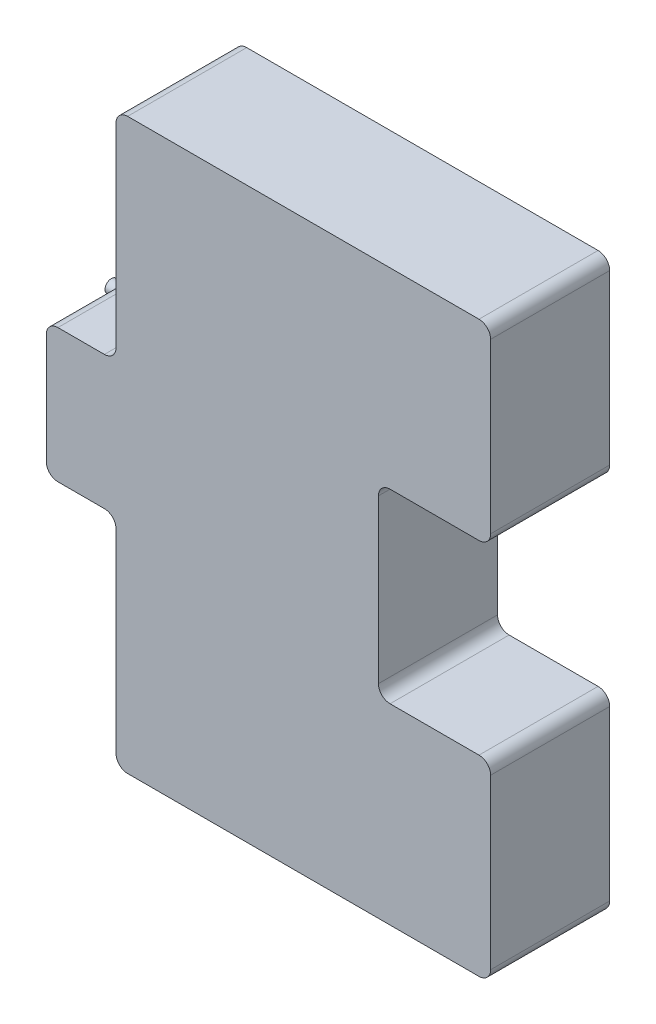
from build123d import *

# Parameters (mm, degrees)
BOSS_EXTRUDE1_DEPTH = 10
FILLET1_R           = 20
BOSS_EXTRUDE2_START = 180
BOSS_EXTRUDE2_DEPTH = 180
BOSS_EXTRUDE3_START = 15
BOSS_EXTRUDE3_DEPTH = 15
BOSS_EXTRUDE4_DEPTH = 15
BOSS_EXTRUDE5_START = 15
SKETCH4_3_R         = 11
BOSS_EXTRUDE5_DEPTH = 38


with BuildPart() as part:
    # Sketch1 → Boss-Extrude1 (new body)
    with BuildSketch(Plane.XY):
        Polygon((-335.812036678, 398.75165032), (309.187963322, 398.75165032), (309.187963322, 68.75165032), (116.024594022, 68.75165032), (116.024594022, -251.24834968), (309.187963322, -251.24834968), (309.187963322, -581.24834968), (-335.812036678, -581.24834968), (-335.812036678, -206.24834968), (-455.812036678, -206.24834968), (-455.812036678, 23.75165032), (-335.812036678, 23.75165032), align=None)
    extrude(amount=BOSS_EXTRUDE1_DEPTH)

    # Fillet1
    fillet1_edges = [part.edges().sort_by_distance(p)[0] for p in [
        (-335.812036678, -206.24834968, 5),
        (-455.812036678, -206.24834968, 5),
        (-455.812036678, 23.75165032, 5),
        (-335.812036678, 23.75165032, 5),
        (-335.812036678, 398.75165032, 5),
        (309.187963322, 398.75165032, 5),
        (309.187963322, 68.75165032, 5),
        (116.024594022, 68.75165032, 5),
        (116.024594022, -251.24834968, 5),
        (309.187963322, -251.24834968, 5),
        (309.187963322, -581.24834968, 5),
        (-335.812036678, -581.24834968, 5),
    ]]
    fillet(fillet1_edges, radius=FILLET1_R)

    # Sketch2 → Boss-Extrude2 (add)
    with BuildSketch(Plane.XY.offset(10).offset(BOSS_EXTRUDE2_START)):
        with BuildLine():
            Line((309.187963322, 88.75165032), (309.187963322, 378.75165032))
            ThreePointArc((309.187963322, 378.75165032), (303.330098945, 392.893785944), (289.187963322, 398.75165032))
            Line((289.187963322, 398.75165032), (-315.812036678, 398.75165032))
            ThreePointArc((-315.812036678, 398.75165032), (-329.954172302, 392.893785944), (-335.812036678, 378.75165032))
            Line((-335.812036678, 378.75165032), (-335.812036678, 43.75165032))
            ThreePointArc((-335.812036678, 43.75165032), (-341.669901055, 29.609514696), (-355.812036678, 23.75165032))
            Line((-355.812036678, 23.75165032), (-435.812036678, 23.75165032))
            ThreePointArc((-435.812036678, 23.75165032), (-449.954172302, 17.893785944), (-455.812036678, 3.75165032))
            Line((-455.812036678, 3.75165032), (-455.812036678, -186.24834968))
            ThreePointArc((-455.812036678, -186.24834968), (-449.954172302, -200.390485304), (-435.812036678, -206.24834968))
            Line((-435.812036678, -206.24834968), (-355.812036678, -206.24834968))
            ThreePointArc((-355.812036678, -206.24834968), (-341.669901055, -212.106214056), (-335.812036678, -226.24834968))
            Line((-335.812036678, -226.24834968), (-335.812036678, -561.24834968))
            ThreePointArc((-335.812036678, -561.24834968), (-329.954172302, -575.390485304), (-315.812036678, -581.24834968))
            Line((-315.812036678, -581.24834968), (289.187963322, -581.24834968))
            ThreePointArc((289.187963322, -581.24834968), (303.330098945, -575.390485304), (309.187963322, -561.24834968))
            Line((309.187963322, -561.24834968), (309.187963322, -271.24834968))
            ThreePointArc((309.187963322, -271.24834968), (303.330098945, -257.106214056), (289.187963322, -251.24834968))
            Line((289.187963322, -251.24834968), (136.024594022, -251.24834968))
            ThreePointArc((136.024594022, -251.24834968), (121.882458398, -245.390485304), (116.024594022, -231.24834968))
            Line((116.024594022, -231.24834968), (116.024594022, 48.75165032))
            ThreePointArc((116.024594022, 48.75165032), (121.882458398, 62.893785944), (136.024594022, 68.75165032))
            Line((136.024594022, 68.75165032), (289.187963322, 68.75165032))
            ThreePointArc((289.187963322, 68.75165032), (303.330098945, 74.609514696), (309.187963322, 88.75165032))
        make_face()
        with BuildLine():
            Line((299.187963322, 88.75165032), (299.187963322, 378.75165032))
            ThreePointArc((299.187963322, 378.75165032), (296.259031134, 385.822718132), (289.187963322, 388.75165032))
            Line((289.187963322, 388.75165032), (-315.812036678, 388.75165032))
            ThreePointArc((-315.812036678, 388.75165032), (-322.88310449, 385.822718132), (-325.812036678, 378.75165032))
            Line((-325.812036678, 378.75165032), (-325.812036678, 43.75165032))
            ThreePointArc((-325.812036678, 43.75165032), (-334.598833243, 22.538446884), (-355.812036678, 13.75165032))
            Line((-355.812036678, 13.75165032), (-435.812036678, 13.75165032))
            ThreePointArc((-435.812036678, 13.75165032), (-442.88310449, 10.822718132), (-445.812036678, 3.75165032))
            Line((-445.812036678, 3.75165032), (-445.812036678, -186.24834968))
            ThreePointArc((-445.812036678, -186.24834968), (-442.88310449, -193.319417492), (-435.812036678, -196.24834968))
            Line((-435.812036678, -196.24834968), (-355.812036678, -196.24834968))
            ThreePointArc((-355.812036678, -196.24834968), (-334.598833243, -205.035146245), (-325.812036678, -226.24834968))
            Line((-325.812036678, -226.24834968), (-325.812036678, -561.24834968))
            ThreePointArc((-325.812036678, -561.24834968), (-322.88310449, -568.319417492), (-315.812036678, -571.24834968))
            Line((-315.812036678, -571.24834968), (289.187963322, -571.24834968))
            ThreePointArc((289.187963322, -571.24834968), (296.259031134, -568.319417492), (299.187963322, -561.24834968))
            Line((299.187963322, -561.24834968), (299.187963322, -271.24834968))
            ThreePointArc((299.187963322, -271.24834968), (296.259031134, -264.177281868), (289.187963322, -261.24834968))
            Line((289.187963322, -261.24834968), (136.024594022, -261.24834968))
            ThreePointArc((136.024594022, -261.24834968), (114.811390587, -252.461553116), (106.024594022, -231.24834968))
            Line((106.024594022, -231.24834968), (106.024594022, 48.75165032))
            ThreePointArc((106.024594022, 48.75165032), (114.811390587, 69.964853755), (136.024594022, 78.75165032))
            Line((136.024594022, 78.75165032), (289.187963322, 78.75165032))
            ThreePointArc((289.187963322, 78.75165032), (296.259031134, 81.680582508), (299.187963322, 88.75165032))
        make_face(mode=Mode.SUBTRACT)
    extrude(amount=-BOSS_EXTRUDE2_DEPTH)

    # Sketch3 → Boss-Extrude3 (add)
    with BuildSketch(Plane.XY.offset(190).offset(BOSS_EXTRUDE3_START)):
        with BuildLine():
            Line((309.187963322, 88.75165032), (309.187963322, 378.75165032))
            ThreePointArc((309.187963322, 378.75165032), (303.330098945, 392.893785944), (289.187963322, 398.75165032))
            Line((289.187963322, 398.75165032), (-315.812036678, 398.75165032))
            ThreePointArc((-315.812036678, 398.75165032), (-329.954172302, 392.893785944), (-335.812036678, 378.75165032))
            Line((-335.812036678, 378.75165032), (-335.812036678, 43.75165032))
            ThreePointArc((-335.812036678, 43.75165032), (-341.669901055, 29.609514696), (-355.812036678, 23.75165032))
            Line((-355.812036678, 23.75165032), (-435.812036678, 23.75165032))
            ThreePointArc((-435.812036678, 23.75165032), (-449.954172302, 17.893785944), (-455.812036678, 3.75165032))
            Line((-455.812036678, 3.75165032), (-455.812036678, -186.24834968))
            ThreePointArc((-455.812036678, -186.24834968), (-449.954172302, -200.390485304), (-435.812036678, -206.24834968))
            Line((-435.812036678, -206.24834968), (-355.812036678, -206.24834968))
            ThreePointArc((-355.812036678, -206.24834968), (-341.669901055, -212.106214056), (-335.812036678, -226.24834968))
            Line((-335.812036678, -226.24834968), (-335.812036678, -561.24834968))
            ThreePointArc((-335.812036678, -561.24834968), (-329.954172302, -575.390485304), (-315.812036678, -581.24834968))
            Line((-315.812036678, -581.24834968), (289.187963322, -581.24834968))
            ThreePointArc((289.187963322, -581.24834968), (303.330098945, -575.390485304), (309.187963322, -561.24834968))
            Line((309.187963322, -561.24834968), (309.187963322, -271.24834968))
            ThreePointArc((309.187963322, -271.24834968), (303.330098945, -257.106214056), (289.187963322, -251.24834968))
            Line((289.187963322, -251.24834968), (136.024594022, -251.24834968))
            ThreePointArc((136.024594022, -251.24834968), (121.882458398, -245.390485304), (116.024594022, -231.24834968))
            Line((116.024594022, -231.24834968), (116.024594022, 48.75165032))
            ThreePointArc((116.024594022, 48.75165032), (121.882458398, 62.893785944), (136.024594022, 68.75165032))
            Line((136.024594022, 68.75165032), (289.187963322, 68.75165032))
            ThreePointArc((289.187963322, 68.75165032), (303.330098945, 74.609514696), (309.187963322, 88.75165032))
        make_face()
    extrude(amount=-BOSS_EXTRUDE3_DEPTH)

    # Sketch4 → Boss-Extrude4 (add)
    with BuildSketch(Plane.ZY.offset(455.812036678)):
        with BuildLine():
            Line((60, -32.244741311), (60, -158.524628982))
            ThreePointArc((60, -158.524628982), (40, -178.524628982), (20, -158.524628982))
            Line((20, -158.524628982), (20, -32.244741311))
            ThreePointArc((20, -32.244741311), (40, -12.244741311), (60, -32.244741311))
        make_face()
    extrude(amount=BOSS_EXTRUDE4_DEPTH)

    # Sketch4<3> → Boss-Extrude5 (add)
    with BuildSketch(Plane.ZY.offset(455.812036678).offset(BOSS_EXTRUDE5_START)):
        with Locations(Location((40, -144.762351153, 0), (0, 0, 270))):
            Circle(SKETCH4_3_R)
        with Locations(Location((40, -118.868830691, 0), (0, 0, 270))):
            Circle(SKETCH4_3_R)
        with Locations(Location((40, -87.715688885, 0), (0, 0, 270))):
            Circle(SKETCH4_3_R)
        with Locations(Location((40, -60.203823394, 0), (0, 0, 270))):
            Circle(SKETCH4_3_R)
        with Locations(Location((40, -33.09654416, 0), (0, 0, 270))):
            Circle(SKETCH4_3_R)
    extrude(amount=BOSS_EXTRUDE5_DEPTH)


solid = part.part
